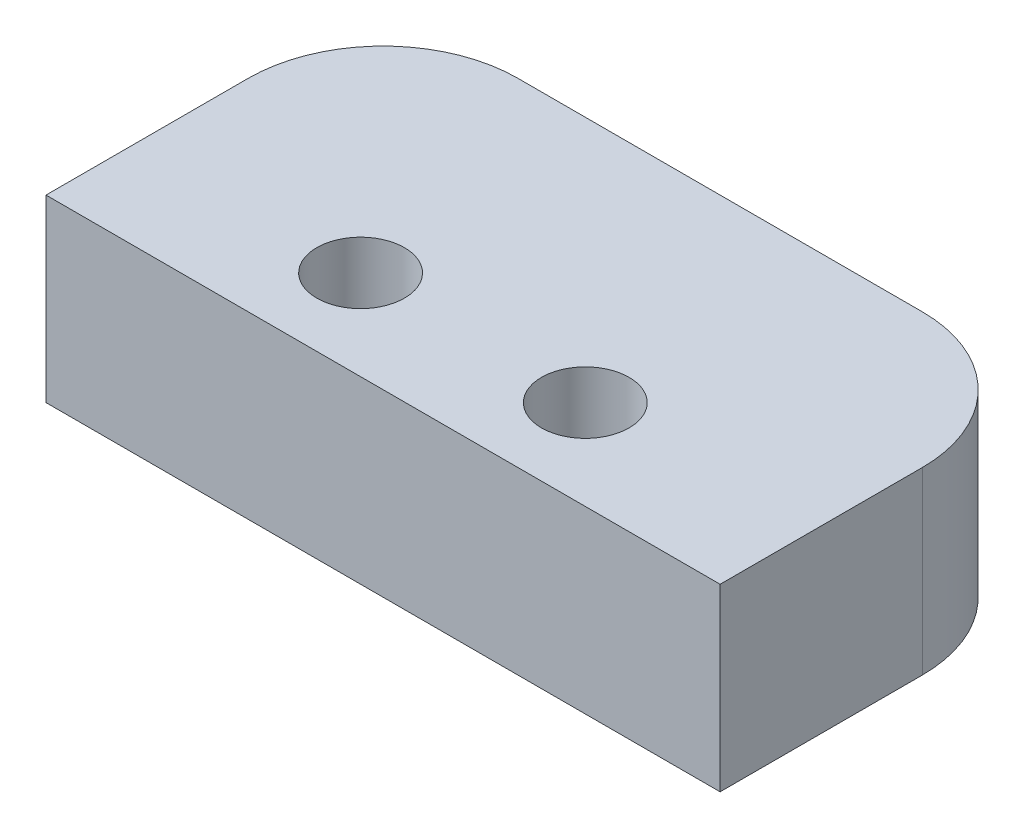
from build123d import *

# Parameters (mm, degrees)
SKETCH_1_W          = 30
SKETCH_1_H          = 15
EXTRUDE_1_DEPTH     = 8
FILLET_1_R          = 6
SKETCH_2_R          = 1.95
CUT_EXTRUDE_1_DEPTH = 19.580904176


with BuildPart() as part:
    # Эскиз1 → Бобышка-Вытянуть1 (new body)
    with BuildSketch(Plane(origin=(0, 0, 0), x_dir=(1, 0, 0), z_dir=(0, 1, 0))):
        Rectangle(SKETCH_1_W, SKETCH_1_H)
    extrude(amount=EXTRUDE_1_DEPTH)

    # Скругление1
    fillet_1_edges = [part.edges().sort_by_distance(p)[0] for p in [
        (-15, 4, -7.5),
        (15, 4, -7.5),
    ]]
    fillet(fillet_1_edges, radius=FILLET_1_R)

    # Эскиз2 → Вырез-Вытянуть1 (cut, through all)
    with BuildSketch(Plane(origin=(0, 8, 0), x_dir=(1, 0, 0), z_dir=(0, 1, 0))):
        with Locations(Location((-5, -3.5, 0), (0, 0, 270))):
            Circle(SKETCH_2_R)
        with Locations(Location((5, -3.5, 0), (0, 0, 270))):
            Circle(SKETCH_2_R)
    extrude(amount=-CUT_EXTRUDE_1_DEPTH, mode=Mode.SUBTRACT)


solid = part.part
